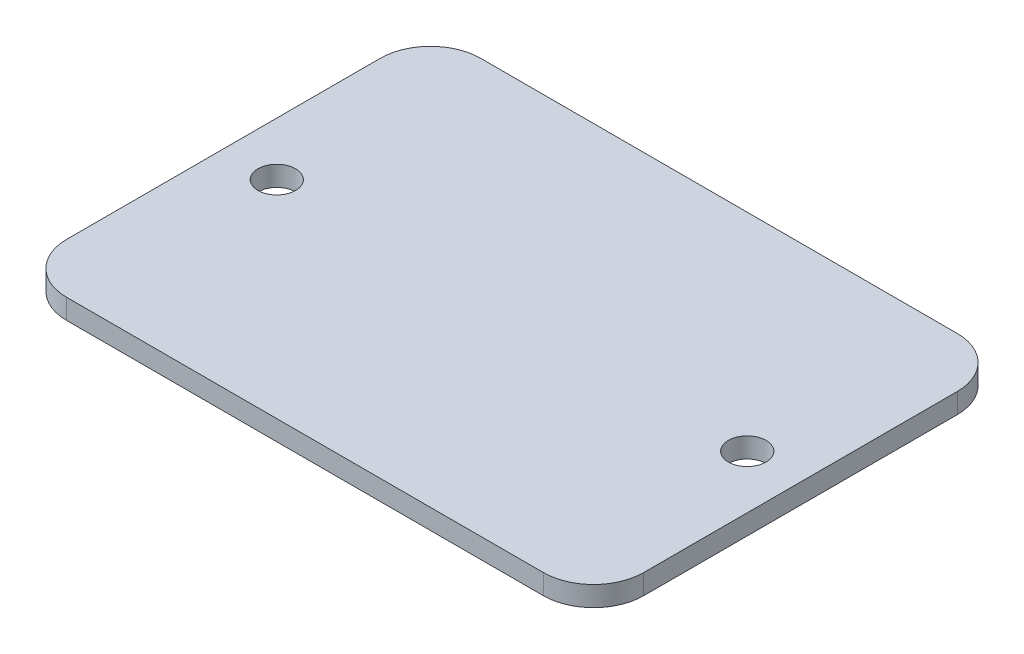
from build123d import *

# Parameters (mm, degrees)
SKETCH1_W           = 46
SKETCH1_H           = 33
SKETCH1_R           = 1.5
BOSS_EXTRUDE1_DEPTH = 1.6
FILLET1_R           = 4


with BuildPart() as part:
    # Sketch1 → Boss-Extrude1 (new body)
    with BuildSketch(Plane(origin=(0, 0, 0), x_dir=(1, 0, 0), z_dir=(0, 1, 0))):
        Rectangle(SKETCH1_W, SKETCH1_H)
        with Locations(Location((-18.75, 0, 0), (0, 0, 270))):
            Circle(SKETCH1_R, mode=Mode.SUBTRACT)
        with Locations(Location((18.75, 0, 0), (0, 0, 90))):
            Circle(SKETCH1_R, mode=Mode.SUBTRACT)
    extrude(amount=BOSS_EXTRUDE1_DEPTH)

    # Fillet1
    fillet1_edges = [part.edges().sort_by_distance(p)[0] for p in [
        (23, 0.8, 16.5),
        (-23, 0.8, 16.5),
        (-23, 0.8, -16.5),
        (23, 0.8, -16.5),
    ]]
    fillet(fillet1_edges, radius=FILLET1_R)


solid = part.part
